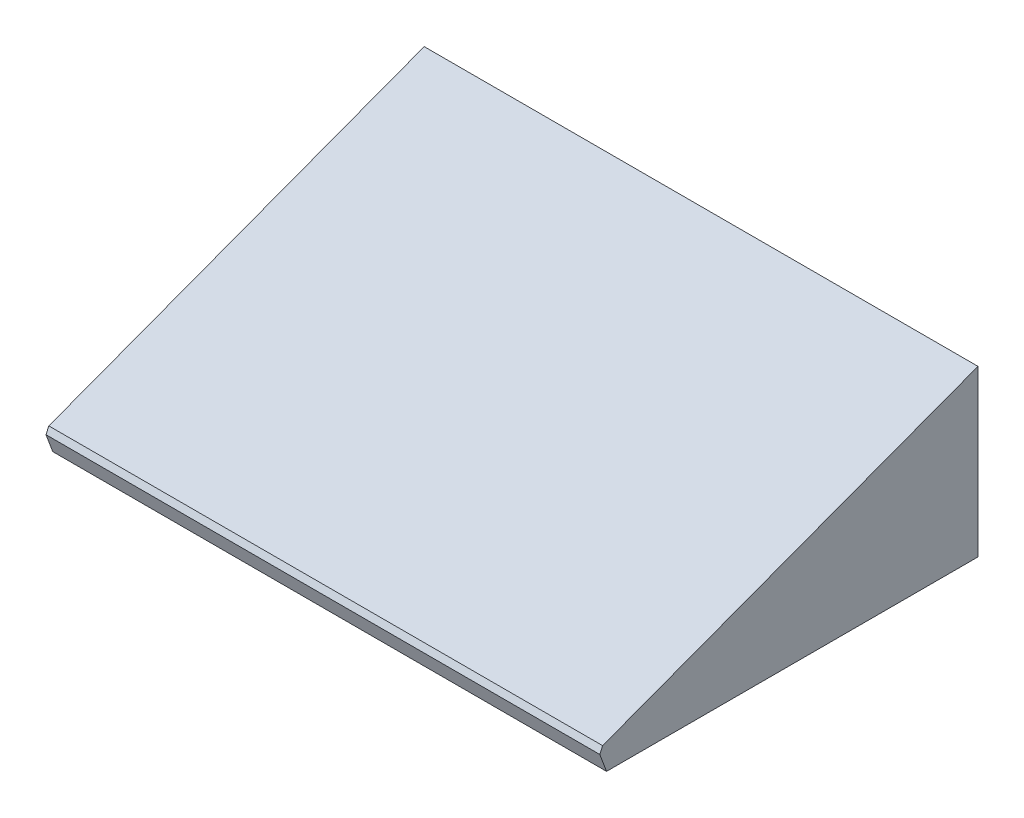
from build123d import *

# Parameters (mm, degrees)
BOSS_EXTRUDE1_DEPTH      = 120
SKETCH2_W                = 85
SKETCH2_H                = 22
CUT_EXTRUDE1_DEPTH       = 15.5
SKETCH3_W                = 31.5
SKETCH3_H                = 71
CUT_EXTRUDE2_DEPTH       = 2
SKETCH4_W                = 26.5
SKETCH4_H                = 42
CUT_EXTRUDE3_DEPTH       = 6
SKETCH5_W                = 77.3
SKETCH5_H                = 30
CUT_EXTRUDE4_DEPTH       = 2
SKETCH6_W                = 77.3
SKETCH6_H                = 33
CUT_EXTRUDE5_DEPTH       = 5
SKETCH7_W                = 8
SKETCH7_H                = 33
CUT_EXTRUDE6_DEPTH       = 5
SKETCH8_W                = 120
SKETCH8_H                = 85.440037453
BOSS_EXTRUDE2_DEPTH      = 5
CHAMFER1_SIZE            = 1
CUT_EXTRUDE7_DEPTH       = 132.502535624
CUT_EXTRUDE7_DEPTH_BACK  = 132.502535624
SKETCH9_W                = 3.45
SKETCH9_H                = 81.404493766
CUT_EXTRUDE8_DEPTH       = 2
CUT_EXTRUDE9_DEPTH       = 129.362063706
CUT_EXTRUDE9_DEPTH_BACK  = 129.362063706
SKETCH11_W               = 116.55
SKETCH11_H               = 3
CUT_EXTRUDE10_REACH      = 128.863
SKETCH12_W               = 18.8
SKETCH12_H               = 13
BOSS_EXTRUDE3_REACH      = 130.331
SKETCH14_W               = 77.3
SKETCH14_H               = 3
CUT_EXTRUDE11_DEPTH      = 129.331216049
CUT_EXTRUDE11_DEPTH_BACK = 129.331216049
SKETCH15_W               = 1.75
SKETCH15_H               = 78.404493766
BOSS_EXTRUDE4_REACH      = 130.331
SKETCH16_W               = 2
SKETCH16_H               = 52
SKETCH17_W               = 5.6
SKETCH17_H               = 12
BOSS_EXTRUDE5_DEPTH      = 3
BOSS_EXTRUDE6_REACH      = 129.09
SKETCH18_W               = 5.6
SKETCH18_H               = 12
BOSS_EXTRUDE7_REACH      = 129.09
SKETCH19_W               = 0.4
SKETCH19_H               = 12
SKETCH20_W               = 69.7
SKETCH20_H               = 1.5
BOSS_EXTRUDE8_DEPTH      = 3


with BuildPart() as part:
    # Sketch1 → Boss-Extrude1 (new body)
    with BuildSketch(Plane(origin=(0, 0, 0), x_dir=(0, 0, -1), z_dir=(1, 0, 0))):
        Polygon((-40, 0), (40, 0), (40, 30), align=None)
    extrude(amount=BOSS_EXTRUDE1_DEPTH)

    # Sketch2 → Cut-Extrude1 (cut)
    with BuildSketch(Plane(origin=(0, 0, 1.820800879), x_dir=(1, 0, 0), z_dir=(0, 1, 0))):
        with Locations((47.25, 27.820800879)):
            Rectangle(SKETCH2_W, SKETCH2_H)
    extrude(amount=CUT_EXTRUDE1_DEPTH, mode=Mode.SUBTRACT)

    # Sketch3 → Cut-Extrude2 (cut)
    with BuildSketch(Plane.XZ):
        with Locations((97.8, -1.5)):
            Rectangle(SKETCH3_W, SKETCH3_H)
    extrude(amount=-CUT_EXTRUDE2_DEPTH, mode=Mode.SUBTRACT)

    # Sketch4 → Cut-Extrude3 (cut)
    with BuildSketch(Plane.XZ):
        with Locations((95.3, -3)):
            Rectangle(SKETCH4_W, SKETCH4_H)
    extrude(amount=-CUT_EXTRUDE3_DEPTH, mode=Mode.SUBTRACT)

    # Sketch5 → Cut-Extrude4 (cut)
    with BuildSketch(Plane.XZ):
        with Locations((43.4, 0)):
            Rectangle(SKETCH5_W, SKETCH5_H)
    extrude(amount=-CUT_EXTRUDE4_DEPTH, mode=Mode.SUBTRACT)

    # Sketch6 → Cut-Extrude5 (cut)
    with BuildSketch(Plane.XZ):
        with Locations((43.4, 1.5)):
            Rectangle(SKETCH6_W, SKETCH6_H)
    extrude(amount=-CUT_EXTRUDE5_DEPTH, mode=Mode.SUBTRACT)

    # Sketch7 → Cut-Extrude6 (cut)
    with BuildSketch(Plane.XZ.offset(-5)):
        with Locations((8.75, 1.5)):
            Rectangle(SKETCH7_W, SKETCH7_H)
    extrude(amount=-CUT_EXTRUDE6_DEPTH, mode=Mode.SUBTRACT)

    # Sketch8 → Boss-Extrude2 (add)
    with BuildSketch(Plane(origin=(0, 13.150684932, 4.931506849), x_dir=(1, 0, 0), z_dir=(0, 0.9363291775690445, 0.35112344158839187))):
        with Locations((60, 5.266851623)):
            Rectangle(SKETCH8_W, SKETCH8_H)
    extrude(amount=BOSS_EXTRUDE2_DEPTH)

    # Chamfer1
    chamfer1_edges = [part.edges().sort_by_distance(p)[0] for p in [
        (60, 34.681645888, -38.244382792),
        (0, 19.681645888, 1.755617208),
        (60, 4.681645888, 41.755617208),
        (120, 19.681645888, 1.755617208),
    ]]
    chamfer(chamfer1_edges, length=CHAMFER1_SIZE)

    # Sketch9 → Cut-Extrude7 (cut, two sides: drawn at the far end of the back side and taken through both)
    with BuildSketch(Plane.XZ.offset(-CUT_EXTRUDE7_DEPTH_BACK)):
        with Locations((118.275, 0.702246883)):
            Rectangle(SKETCH9_W, SKETCH9_H)
    extrude(amount=CUT_EXTRUDE7_DEPTH + CUT_EXTRUDE7_DEPTH_BACK, mode=Mode.SUBTRACT)

    # Sketch10 → Cut-Extrude8 (cut)
    # profile 1 of 5: a face of its own
    with BuildSketch(Plane.XZ):
        with BuildLine():
            Line((78.674757455, 22.075824653), (77.011317418, 22.075824653))
            add(Edge.make_bspline(
                [(77.011317418, 22.075824653), (76.878435546, 22.07595297), (76.623589999, 22.076199063), (76.257744458, 22.083182699), (75.92525222, 22.09284626), (75.626561821, 22.105060494), (75.361863908, 22.123275147), (75.130458125, 22.144275755), (74.932116287, 22.167682755), (74.762586288, 22.197238486), (74.613628351, 22.235473372), (74.476153709, 22.285718991), (74.344601297, 22.345499415), (74.220549035, 22.420229966), (74.104698916, 22.50783575), (73.993275585, 22.604856404), (73.889980779, 22.715714018), (73.792498963, 22.838734053), (73.704041964, 22.978165814), (73.629558606, 23.136671686), (73.564863727, 23.313209023), (73.515571852, 23.509830167), (73.474533559, 23.724465961), (73.445010584, 23.958382837), (73.429613616, 24.211512287), (73.426734686, 24.386685786), (73.425242545, 24.477477724)],
                knots=[0, 0, 0, 0, 1.858880145, 3.565025999, 5.118582639, 6.512162874, 7.746627373, 8.829802369, 9.762494906, 10.539753326, 11.235534943, 11.910656988, 12.584911712, 13.253982634, 13.931743152, 14.614664357, 15.318182461, 16.048152879, 16.807936597, 17.622255883, 18.493442962, 19.434131938, 20.454320809, 21.549263075, 22.729789868, 24, 24, 24, 24], degree=3))
            add(Edge.make_bspline(
                [(73.425242545, 24.477477724), (73.425446641, 24.559531562), (73.425837444, 24.716648897), (73.440461214, 24.9419758), (73.457802584, 25.146560087), (73.488469585, 25.329758575), (73.523107287, 25.492449213), (73.566946587, 25.634425509), (73.618910557, 25.755427292), (73.680726611, 25.858175598), (73.757626186, 25.943800606), (73.847209761, 26.019592742), (73.951879841, 26.088016339), (74.073792907, 26.144476582), (74.211203676, 26.191064823), (74.362604976, 26.232858085), (74.530572884, 26.263724943), (74.64838118, 26.275740848), (74.709733225, 26.281998475)],
                knots=[0, 0, 0, 0, 1.535878471, 2.940912188, 4.226580884, 5.377875331, 6.416190362, 7.33905643, 8.155105775, 8.876813729, 9.5731673, 10.299435969, 11.06901144, 11.907113296, 12.807267139, 13.783346309, 14.845614092, 16, 16, 16, 16], degree=3))
            add(Edge.make_bspline(
                [(74.709733225, 26.281998475), (74.654422492, 26.297014006), (74.547702366, 26.325985949), (74.394859672, 26.372603964), (74.256538903, 26.424766406), (74.133798283, 26.482474553), (74.024401633, 26.541563254), (73.928268324, 26.603166691), (73.847268636, 26.670972045), (73.759747534, 26.763510376), (73.67336115, 26.881282505), (73.586017308, 27.017050142), (73.522932093, 27.148151401), (73.484160771, 27.258863208), (73.467458526, 27.360547213), (73.456651095, 27.461860465), (73.447125334, 27.589902164), (73.439153463, 27.744146158), (73.43290263, 27.924625534), (73.427515092, 28.131328177), (73.427057246, 28.364855993), (73.425869799, 28.529448256), (73.425242545, 28.616392136)],
                knots=[0, 0, 0, 0, 1.142275764, 2.203981192, 3.183643981, 4.085664085, 4.905018897, 5.660725403, 6.357043098, 7.004570698, 8.194716381, 9.262167886, 10.217584673, 11.089541224, 11.587668304, 12.267674913, 13.120277493, 14.146194667, 15.345833634, 16.719447104, 18.267087457, 20, 20, 20, 20], degree=3))
            Line((73.425242545, 28.616392136), (73.425242545, 31))
            Line((73.425242545, 31), (75.630038807, 31))
            Line((75.630038807, 31), (75.630038807, 27.981528927))
            add(Edge.make_bspline(
                [(75.630038807, 27.981528927), (75.630372338, 27.923564744), (75.631004923, 27.813627948), (75.635168416, 27.657654363), (75.645285282, 27.519259747), (75.658034019, 27.39773335), (75.673856065, 27.293025077), (75.693070817, 27.205694171), (75.715245867, 27.135201519), (75.743576662, 27.079275801), (75.782103964, 27.035512966), (75.831945376, 27.001551448), (75.890508015, 26.969276312), (75.963490767, 26.948127682), (76.046386707, 26.927583312), (76.14215697, 26.915746313), (76.249435215, 26.9072739), (76.325030554, 26.906033649), (76.364970895, 26.90537837)],
                knots=[0, 0, 0, 0, 1.760293709, 3.338631625, 4.737073145, 5.97306278, 7.048729386, 7.951113975, 8.686284323, 9.288001362, 9.841002111, 10.435573434, 11.111533751, 11.86247611, 12.732499885, 13.704755261, 14.787321331, 16, 16, 16, 16], degree=3))
            Line((76.364970895, 26.90537837), (76.364970895, 31))
            Line((76.364970895, 31), (78.674757455, 31))
            Line((78.674757455, 31), (78.674757455, 22.075824653))
        make_face()
        with BuildLine():
            Line((76.364970895, 23.545688828), (76.364970895, 25.540504493))
            add(Edge.make_bspline(
                [(76.364970895, 25.540504493), (76.302062458, 25.539365655), (76.185719936, 25.537259492), (76.025550815, 25.519512372), (75.896371231, 25.485438875), (75.805659055, 25.446554497), (75.751046731, 25.397344404), (75.718242349, 25.345810211), (75.691274032, 25.279537085), (75.668711124, 25.198559824), (75.651280675, 25.10300993), (75.637968064, 24.992924997), (75.632632499, 24.867411111), (75.630937926, 24.778778447), (75.630038807, 24.731751103)],
                knots=[0, 0, 0, 0, 1.705596533, 3.154321019, 4.351629806, 5.326076963, 5.787715205, 6.322141217, 6.966357786, 7.721714139, 8.596732776, 9.596881849, 10.724936624, 12, 12, 12, 12], degree=3))
            Line((75.630038807, 24.731751103), (75.630038807, 24.237968606))
            add(Edge.make_bspline(
                [(75.630038807, 24.237968606), (75.631508762, 24.172761473), (75.634183698, 24.054101472), (75.662460333, 23.893577859), (75.709629214, 23.767416706), (75.783012195, 23.672348501), (75.888681707, 23.614238442), (76.01860844, 23.572151866), (76.181604066, 23.549574739), (76.300392089, 23.547057382), (76.364970895, 23.545688828)],
                knots=[0, 0, 0, 0, 1.304469539, 2.37379483, 3.247992823, 3.979792534, 4.721435155, 5.621572954, 6.706974207, 8, 8, 8, 8], degree=3))
        make_face(mode=Mode.SUBTRACT)
    # profile 2 of 5: a face of its own
    with BuildSketch(Plane.XZ):
        with BuildLine():
            Line((54.127834712, 22.075824653), (54.127834712, 31))
            Line((54.127834712, 31), (56.122650378, 31))
            Line((56.122650378, 31), (56.175145527, 24.974541167))
            Line((56.175145527, 24.974541167), (56.962572763, 31))
            Line((56.962572763, 31), (58.537427237, 31))
            Line((58.537427237, 31), (59.324854473, 25.079531465))
            Line((59.324854473, 25.079531465), (59.377349622, 31))
            Line((59.377349622, 31), (61.372165288, 31))
            Line((61.372165288, 31), (61.372165288, 22.075824653))
            Line((61.372165288, 22.075824653), (58.458684513, 22.075824653))
            add(Edge.make_bspline(
                [(58.458684513, 22.075824653), (58.434649146, 22.214175541), (58.384393379, 22.50345467), (58.305329656, 22.955528793), (58.222074935, 23.445101588), (58.163991875, 23.783565353), (58.133870778, 23.959088127)],
                knots=[0, 0, 0, 0, 0.881745717, 1.843650135, 2.881745852, 4, 4, 4, 4], degree=3))
            Line((58.133870778, 23.959088127), (57.75, 26.242627113))
            Line((57.75, 26.242627113), (57.146305785, 22.075824653))
            Line((57.146305785, 22.075824653), (54.127834712, 22.075824653))
        make_face()
    # profile 3 of 5: a face of its own
    with BuildSketch(Plane.XZ):
        with BuildLine():
            Line((43.480135825, 22.075824653), (43.480135825, 28.040585969))
            add(Edge.make_bspline(
                [(43.480135825, 28.040585969), (43.480022037, 28.147216724), (43.479804962, 28.350636938), (43.48126573, 28.640462596), (43.484902556, 28.900196242), (43.488203109, 29.129862779), (43.491048577, 29.330019029), (43.495517068, 29.500668415), (43.502663332, 29.641164293), (43.509633137, 29.787810757), (43.532688792, 29.94877205), (43.587343026, 30.128248928), (43.667197223, 30.298989639), (43.773833054, 30.456273271), (43.900923125, 30.59993445), (44.049829166, 30.720040911), (44.216500286, 30.817357166), (44.370752824, 30.875003958), (44.505786635, 30.911668685), (44.620687885, 30.936458509), (44.748481852, 30.955166878), (44.887977017, 30.97164147), (45.039532401, 30.98450533), (45.203054266, 30.994657011), (45.379232976, 30.999013954), (45.500651063, 30.999663553), (45.563537055, 31)],
                knots=[0, 0, 0, 0, 1.739000746, 3.317503537, 4.72665292, 5.975293669, 7.063430065, 7.991282922, 8.759055969, 9.357622673, 10.385511005, 11.401140126, 12.406458823, 13.447761061, 14.489788613, 15.523232721, 16.554172721, 17.624066887, 18.1973879, 18.835816144, 19.539600257, 20.30285405, 21.126401739, 22.019800782, 22.974396685, 24, 24, 24, 24], degree=3))
            Line((45.563537055, 31), (46.734835069, 31))
            Line((46.734835069, 31), (46.734835069, 29.513731091))
            add(Edge.make_bspline(
                [(46.734835069, 29.513731091), (46.699822791, 29.515642569), (46.635245655, 29.519168127), (46.546310944, 29.527921575), (46.472890276, 29.528051479), (46.429156567, 29.529501419), (46.410021334, 29.530135825)],
                knots=[0, 0, 0, 0, 1.293503883, 2.385756683, 3.293704533, 4, 4, 4, 4], degree=3))
            add(Edge.make_bspline(
                [(46.410021334, 29.530135825), (46.367779717, 29.52865456), (46.287531446, 29.525840535), (46.174226213, 29.502282032), (46.073540407, 29.465794953), (45.99017961, 29.410054766), (45.919558074, 29.347024548), (45.868911865, 29.272168563), (45.828835769, 29.193448241), (45.809629396, 29.099502157), (45.801625896, 28.982929785), (45.795673956, 28.830787126), (45.790491621, 28.637205967), (45.790123855, 28.494455669), (45.789922386, 28.41625438)],
                knots=[0, 0, 0, 0, 1.016720791, 1.931509528, 2.778190365, 3.578596618, 4.333801826, 5.043006415, 5.744333444, 6.447514694, 7.333867413, 8.560407009, 10.115726477, 12, 12, 12, 12], degree=3))
            Line((45.789922386, 28.41625438), (45.789922386, 22.075824653))
            Line((45.789922386, 22.075824653), (43.480135825, 22.075824653))
        make_face()
    # profile 4 of 5: a face of its own
    with BuildSketch(Plane.XZ):
        with BuildLine():
            Line((34.564776859, 22.075824653), (32.209057043, 22.075824653))
            add(Edge.make_bspline(
                [(32.209057043, 22.075824653), (32.131397877, 22.075809825), (31.980952028, 22.075781101), (31.762749756, 22.084917886), (31.558777533, 22.096430971), (31.368162168, 22.109798728), (31.191123374, 22.132194374), (31.027290879, 22.155767851), (30.87771982, 22.185012246), (30.701473858, 22.230315507), (30.503829947, 22.296489586), (30.293502404, 22.395109965), (30.113328233, 22.508025149), (29.964058395, 22.639380283), (29.845186464, 22.78915158), (29.745986003, 22.950335173), (29.667710304, 23.126742694), (29.622178177, 23.286023943), (29.594054136, 23.424890731), (29.576680252, 23.543833263), (29.559983925, 23.676116997), (29.547255438, 23.822230987), (29.537379999, 23.981407437), (29.531558179, 24.153732288), (29.525944743, 24.339643131), (29.525482487, 24.468176538), (29.525242545, 24.534894293)],
                knots=[0, 0, 0, 0, 1.281964286, 2.483495709, 3.604712, 4.655071645, 5.637100492, 6.549969518, 7.387406721, 8.151567794, 9.553304389, 10.821333866, 11.978323592, 13.052657067, 14.086121002, 15.123481177, 16.170265516, 17.26153408, 17.851105376, 18.508641333, 19.245436095, 20.052140212, 20.929500139, 21.878095547, 22.898584377, 24, 24, 24, 24], degree=3))
            Line((29.525242545, 24.534894293), (29.525242545, 25.300995376))
            add(Edge.make_bspline(
                [(29.525242545, 25.300995376), (29.525935147, 25.368811257), (29.527270605, 25.499572131), (29.535685551, 25.688851364), (29.54807143, 25.864045859), (29.567186358, 26.025137911), (29.594212191, 26.170981714), (29.622718705, 26.303450463), (29.658260279, 26.421713323), (29.715148533, 26.55963507), (29.806808485, 26.716505577), (29.958514653, 26.876934905), (30.145878395, 27.014736167), (30.370865499, 27.12744643), (30.631907645, 27.21666573), (30.928944871, 27.281784568), (31.262692226, 27.318187814), (31.497001399, 27.322875998), (31.620127089, 27.325339563)],
                knots=[0, 0, 0, 0, 0.947757586, 1.82744229, 2.647441348, 3.401971956, 4.093032504, 4.719693918, 5.295046441, 5.815895592, 6.802806765, 7.814036364, 8.879378309, 10.038024405, 11.316559909, 12.72571424, 14.27941567, 16, 16, 16, 16], degree=3))
            Line((31.620127089, 27.325339563), (32.254990298, 27.325339563))
            Line((32.254990298, 27.325339563), (32.254990298, 31))
            Line((32.254990298, 31), (34.564776859, 31))
            Line((34.564776859, 31), (34.564776859, 22.075824653))
        make_face()
        with BuildLine():
            Line((32.254990298, 23.545688828), (32.254990298, 25.850553968))
            add(Edge.make_bspline(
                [(32.254990298, 25.850553968), (32.224371595, 25.851770253), (32.16751932, 25.854028631), (32.110631183, 25.855018588), (32.084381064, 25.855475388)],
                knots=[0, 0, 0, 0, 1.077132021, 2, 2, 2, 2], degree=3))
            add(Edge.make_bspline(
                [(32.084381064, 25.855475388), (32.03501447, 25.853920853), (31.943966534, 25.851053789), (31.818142809, 25.822253495), (31.717080787, 25.771109568), (31.634612009, 25.696787827), (31.580576616, 25.585744833), (31.545312064, 25.438593599), (31.5240905, 25.250177401), (31.521484577, 25.110210096), (31.520058211, 25.03359821)],
                knots=[0, 0, 0, 0, 1.014036035, 1.870209798, 2.62944783, 3.321454405, 4.111047744, 5.122712929, 6.425100841, 8, 8, 8, 8], degree=3))
            Line((31.520058211, 25.03359821), (31.520058211, 24.288823282))
            add(Edge.make_bspline(
                [(31.520058211, 24.288823282), (31.520879329, 24.218146959), (31.522370716, 24.089778378), (31.550149018, 23.917015425), (31.590821697, 23.782031383), (31.656849787, 23.679476677), (31.759754254, 23.615559867), (31.892207834, 23.573650131), (32.061627425, 23.548862433), (32.186550972, 23.546812101), (32.254990298, 23.545688828)],
                knots=[0, 0, 0, 0, 1.352008203, 2.455636734, 3.339892592, 4.040006677, 4.734221151, 5.608560507, 6.68985064, 8, 8, 8, 8], degree=3))
        make_face(mode=Mode.SUBTRACT)
    # profile 5 of 5: a face of its own
    with BuildSketch(Plane.XZ):
        with BuildLine():
            Line((16.620252247, 25.855475388), (18.930038807, 25.855475388))
            Line((18.930038807, 25.855475388), (18.930038807, 24.329835117))
            add(Edge.make_bspline(
                [(18.930038807, 24.329835117), (18.93043828, 24.277337984), (18.93119985, 24.177255335), (18.93457808, 24.034520408), (18.938949617, 23.907043228), (18.946454463, 23.795316985), (18.959010063, 23.69981442), (18.969255788, 23.61903873), (18.983154386, 23.553339422), (19.006324599, 23.488564544), (19.04724035, 23.423271717), (19.123566924, 23.370857688), (19.220255997, 23.339649201), (19.29176765, 23.337088511), (19.330314319, 23.335708231)],
                knots=[0, 0, 0, 0, 1.543931605, 2.943413364, 4.198717191, 5.295228303, 6.234738305, 7.03074424, 7.690095925, 8.20395749, 9.051421383, 9.90390575, 10.870149872, 12, 12, 12, 12], degree=3))
            add(Edge.make_bspline(
                [(19.330314319, 23.335708231), (19.373936873, 23.337635721), (19.4545964, 23.341199714), (19.563060529, 23.381937227), (19.648712062, 23.44813529), (19.69023631, 23.529886462), (19.712978002, 23.607864318), (19.729132237, 23.682982987), (19.741825989, 23.773428777), (19.751024312, 23.87860677), (19.759111608, 23.998387013), (19.766006085, 24.132907353), (19.768634946, 24.282798837), (19.76950405, 24.38779858), (19.769961193, 24.443027783)],
                knots=[0, 0, 0, 0, 1.155601709, 2.136745305, 3.036825798, 3.968359586, 4.51619557, 5.201290112, 6.010152394, 6.94565669, 8.010546848, 9.20534785, 10.530030616, 12, 12, 12, 12], degree=3))
            Line((19.769961193, 24.443027783), (19.769961193, 28.672168232))
            add(Edge.make_bspline(
                [(19.769961193, 28.672168232), (19.769505462, 28.725210049), (19.768640896, 28.825835494), (19.765998432, 28.969715407), (19.759039172, 29.099306639), (19.751163343, 29.214735516), (19.741706763, 29.316055677), (19.729252984, 29.402748346), (19.71273868, 29.474986929), (19.690501973, 29.550660026), (19.647502959, 29.62775679), (19.569187466, 29.696075715), (19.464559252, 29.733855406), (19.388038494, 29.737921061), (19.346719053, 29.740116422)],
                knots=[0, 0, 0, 0, 1.468835776, 2.786523222, 3.984260338, 5.061992945, 5.990102038, 6.801709896, 7.484940509, 8.040462122, 8.98327679, 9.884947154, 10.85792034, 12, 12, 12, 12], degree=3))
            add(Edge.make_bspline(
                [(19.346719053, 29.740116422), (19.306961124, 29.738072207), (19.232754327, 29.734256753), (19.130996294, 29.693403069), (19.053533095, 29.622248755), (19.01060746, 29.540782892), (18.988702799, 29.459120278), (18.972153563, 29.378656146), (18.960349101, 29.280388633), (18.948105949, 29.16453066), (18.941106973, 29.030379743), (18.933925074, 28.878390895), (18.93137857, 28.708264834), (18.930501467, 28.589050118), (18.930038807, 28.526166099)],
                knots=[0, 0, 0, 0, 0.993861569, 1.855008177, 2.690191265, 3.580355277, 4.123088185, 4.809185674, 5.639622724, 6.604756937, 7.731821249, 9.008887029, 10.422231637, 12, 12, 12, 12], degree=3))
            Line((18.930038807, 28.526166099), (18.930038807, 27.325339563))
            Line((18.930038807, 27.325339563), (16.620252247, 27.325339563))
            Line((16.620252247, 27.325339563), (16.620252247, 27.68460324))
            add(Edge.make_bspline(
                [(16.620252247, 27.68460324), (16.621050729, 27.799437448), (16.622587067, 28.020387008), (16.62952579, 28.338804167), (16.646589657, 28.630833481), (16.667670155, 28.897224215), (16.69277975, 29.137628679), (16.725502804, 29.352251984), (16.76394815, 29.54090541), (16.81042426, 29.707849841), (16.867401587, 29.859662833), (16.938134129, 30.003525946), (17.02602059, 30.140908779), (17.126900412, 30.274744647), (17.241278458, 30.404507274), (17.372603698, 30.527610674), (17.516931742, 30.647438957), (17.675105818, 30.762109115), (17.846335039, 30.866153548), (18.028115394, 30.95889657), (18.219303484, 31.037747524), (18.421674436, 31.099899187), (18.632820442, 31.148642688), (18.853547901, 31.185034718), (19.083803627, 31.206718482), (19.240588128, 31.208879523), (19.320471479, 31.209980596)],
                knots=[0, 0, 0, 0, 1.603845056, 3.085917197, 4.447448706, 5.688621609, 6.817892571, 7.822384546, 8.719562717, 9.505284604, 10.240026988, 10.981171272, 11.739699879, 12.514094308, 13.320187971, 14.15209653, 15.025291148, 15.938832187, 16.877936158, 17.820604456, 18.786407097, 19.762272488, 20.773736871, 21.810796858, 22.884577996, 24, 24, 24, 24], degree=3))
            add(Edge.make_bspline(
                [(19.320471479, 31.209980596), (19.403059552, 31.208451086), (19.564569107, 31.205459971), (19.801872476, 31.189957269), (20.027778776, 31.159450988), (20.24356753, 31.121538441), (20.447267483, 31.068474098), (20.63984262, 31.00482462), (20.821259871, 30.928910269), (20.991398537, 30.842501413), (21.149560355, 30.745606195), (21.293959437, 30.639167399), (21.424818745, 30.52351161), (21.541539482, 30.398998248), (21.643542064, 30.264995259), (21.733332214, 30.123491681), (21.807132727, 29.971275654), (21.867840437, 29.808374607), (21.919648092, 29.631329914), (21.960607168, 29.435193639), (21.999278787, 29.219328789), (22.026943864, 28.982533798), (22.052884019, 28.725633898), (22.067848065, 28.447567274), (22.078084446, 28.148936248), (22.079181734, 27.94326151), (22.079747753, 27.837167267)],
                knots=[0, 0, 0, 0, 1.164956474, 2.278193397, 3.351497566, 4.37861597, 5.366264342, 6.317405631, 7.236942475, 8.137162529, 9.006184963, 9.849926367, 10.663960312, 11.46607015, 12.252756238, 13.035918731, 13.825773911, 14.633646955, 15.485386752, 16.42479307, 17.458146638, 18.57735156, 19.786009614, 21.099356435, 22.503746307, 24, 24, 24, 24], degree=3))
            Line((22.079747753, 27.837167267), (22.079747753, 25.217331232))
            add(Edge.make_bspline(
                [(22.079747753, 25.217331232), (22.079057983, 25.139138538), (22.077721852, 24.987674119), (22.078118056, 24.767773762), (22.069526198, 24.563343454), (22.064793735, 24.373461486), (22.053240792, 24.199170169), (22.045907828, 24.039695693), (22.028909087, 23.896196168), (22.011992673, 23.724197885), (21.969749857, 23.519406758), (21.886501194, 23.282288962), (21.772395929, 23.048760442), (21.62506421, 22.823763848), (21.446789035, 22.611387495), (21.234628435, 22.420856953), (20.988975521, 22.256986279), (20.715102409, 22.116211362), (20.414829352, 22.002971186), (20.090555186, 21.92299043), (19.745142702, 21.875171786), (19.507640064, 21.869001764), (19.386090415, 21.865844056)],
                knots=[0, 0, 0, 0, 0.937442324, 1.815887763, 2.635729755, 3.390054394, 4.09258201, 4.729669214, 5.303030834, 5.824255724, 6.801337323, 7.800597511, 8.829646091, 9.909673618, 11.016776264, 12.144778007, 13.315679796, 14.547062252, 15.82913781, 17.153535583, 18.543229853, 20, 20, 20, 20], degree=3))
            add(Edge.make_bspline(
                [(19.386090415, 21.865844056), (19.302935937, 21.867147222), (19.140256064, 21.86969668), (18.901552884, 21.888382193), (18.673446749, 21.916785113), (18.456648938, 21.959994921), (18.250704261, 22.013332555), (18.056811523, 22.08098714), (17.873729088, 22.160027495), (17.701933259, 22.249704192), (17.543154199, 22.349486043), (17.398770714, 22.456933992), (17.26624611, 22.567209238), (17.151135044, 22.687542957), (17.047165986, 22.810628769), (16.959748885, 22.942150778), (16.885481685, 23.078021839), (16.825022142, 23.22333294), (16.776212916, 23.381802966), (16.733262846, 23.557532934), (16.700393052, 23.753495573), (16.670266932, 23.968924335), (16.648003127, 24.204852787), (16.631851456, 24.460885638), (16.621975772, 24.736595019), (16.620839705, 24.926959051), (16.620252247, 25.025395843)],
                knots=[0, 0, 0, 0, 1.221037824, 2.388786318, 3.514327057, 4.594701967, 5.632888524, 6.636041322, 7.607184222, 8.559044852, 9.479213783, 10.357759034, 11.200908957, 12.007311002, 12.800042518, 13.563982942, 14.322161534, 15.070839516, 15.870858808, 16.755110859, 17.725489825, 18.787351681, 19.949176275, 21.20448417, 22.554445354, 24, 24, 24, 24], degree=3))
            Line((16.620252247, 25.025395843), (16.620252247, 25.855475388))
        make_face()
    extrude(amount=-CUT_EXTRUDE8_DEPTH, mode=Mode.SUBTRACT)

    # Sketch11 → Cut-Extrude9 (cut, two sides: drawn at the far end of the back side and taken through both)
    with BuildSketch(Plane.XZ.offset(-CUT_EXTRUDE9_DEPTH_BACK)):
        with Locations((58.275, -38.5)):
            Rectangle(SKETCH11_W, SKETCH11_H)
    extrude(amount=CUT_EXTRUDE9_DEPTH + CUT_EXTRUDE9_DEPTH_BACK, mode=Mode.SUBTRACT)

    # Sketch12 → Cut-Extrude10 (cut, up to next)
    with BuildSketch(Plane.XZ.offset(-6), mode=Mode.PRIVATE) as cut_extrude10_sk1:
        with Locations((99.15, -30.5)):
            Rectangle(SKETCH12_W, SKETCH12_H)
    cut_extrude10_tool1 = extrude(cut_extrude10_sk1.sketch, amount=CUT_EXTRUDE10_REACH, mode=Mode.PRIVATE) & part.part
    add(cut_extrude10_tool1.solids().sort_by_distance((99.15, 6, -30.5))[0], mode=Mode.SUBTRACT)

    # Sketch14 → Boss-Extrude3 (add, up to next)
    with BuildSketch(Plane.XZ, mode=Mode.PRIVATE) as boss_extrude3_sk1:
        with Locations((43.4, 16.5)):
            Rectangle(SKETCH14_W, SKETCH14_H)
    boss_extrude3_tool1 = extrude(boss_extrude3_sk1.sketch, amount=-BOSS_EXTRUDE3_REACH, mode=Mode.PRIVATE) - part.part
    add(boss_extrude3_tool1.solids().sort_by_distance((43.4, 0, 16.5))[0])

    # Sketch15 → Cut-Extrude11 (cut, two sides: drawn at the far end of the back side and taken through both)
    with BuildSketch(Plane.XZ.offset(-CUT_EXTRUDE11_DEPTH_BACK)):
        with Locations((0.875, 2.202246883)):
            Rectangle(SKETCH15_W, SKETCH15_H)
    extrude(amount=CUT_EXTRUDE11_DEPTH + CUT_EXTRUDE11_DEPTH_BACK, mode=Mode.SUBTRACT)

    # Sketch16 → Boss-Extrude4 (add, up to next)
    with BuildSketch(Plane.XZ, mode=Mode.PRIVATE) as boss_extrude4_sk1:
        with Locations((5.75, -11)):
            Rectangle(SKETCH16_W, SKETCH16_H)
    boss_extrude4_tool1 = extrude(boss_extrude4_sk1.sketch, amount=-BOSS_EXTRUDE4_REACH, mode=Mode.PRIVATE) - part.part
    add(boss_extrude4_tool1.solids().sort_by_distance((5.75, 0, -11))[0])

    # Sketch17 → Boss-Extrude5 (add)
    with BuildSketch(Plane.XZ.offset(-5)):
        with Locations((9.55, 9)):
            Rectangle(SKETCH17_W, SKETCH17_H)
    extrude(amount=BOSS_EXTRUDE5_DEPTH)

    # Sketch18 → Boss-Extrude6 (add, up to next)
    with BuildSketch(Plane(origin=(0, 5, 0), x_dir=(1, 0, 0), z_dir=(0, 1, 0)), mode=Mode.PRIVATE) as boss_extrude6_sk1:
        with Locations((9.55, -9)):
            Rectangle(SKETCH18_W, SKETCH18_H)
    boss_extrude6_tool1 = extrude(boss_extrude6_sk1.sketch, amount=BOSS_EXTRUDE6_REACH, mode=Mode.PRIVATE) - part.part
    add(boss_extrude6_tool1.solids().sort_by_distance((9.55, 5, 9))[0])

    # Sketch19 → Boss-Extrude7 (add, up to next)
    with BuildSketch(Plane.XZ.offset(-5), mode=Mode.PRIVATE) as boss_extrude7_sk1:
        with Locations((12.55, 9)):
            Rectangle(SKETCH19_W, SKETCH19_H)
    boss_extrude7_tool1 = extrude(boss_extrude7_sk1.sketch, amount=-BOSS_EXTRUDE7_REACH, mode=Mode.PRIVATE) - part.part
    add(boss_extrude7_tool1.solids().sort_by_distance((12.55, 5, 9))[0])

    # Sketch20 → Boss-Extrude8 (add)
    with BuildSketch(Plane.XZ.offset(-5)):
        with Locations((47.2, 14.25)):
            Rectangle(SKETCH20_W, SKETCH20_H)
    extrude(amount=BOSS_EXTRUDE8_DEPTH)


solid = part.part
